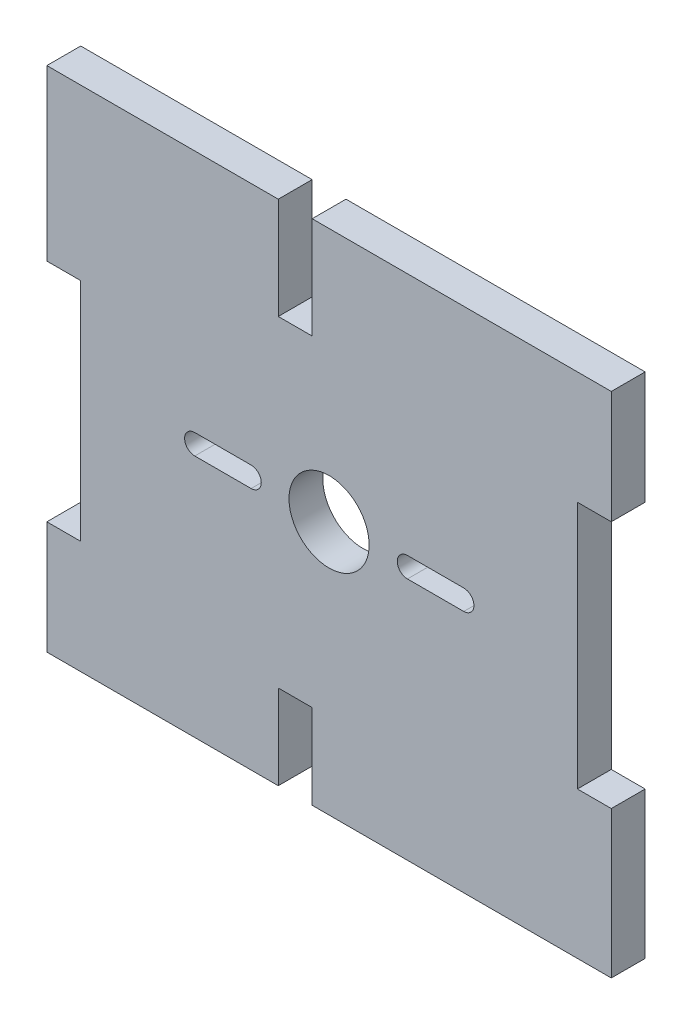
from build123d import *

# Parameters (mm, degrees)
SKETCH_1_R      = 3.55
EXTRUDE_1_DEPTH = 3


with BuildPart() as part:
    # 草图1 → 凸台-拉伸1 (new body)
    with BuildSketch(Plane.XY.offset(3)):
        Polygon((46.131858504, 44.9999), (19.632388504, 44.9999), (19.632388504, 35.9998), (16.632358504, 35.9998), (16.632358504, 44.9999), (-3.867371496, 44.9999), (-3.867371496, 29.9998), (-0.867341496, 29.9998), (-0.867341496, 9.9991), (-3.867371496, 9.9991), (-3.867371496, 0), (16.632358504, 0), (16.632358504, 7.4993), (19.632388504, 7.4993), (19.632388504, 0), (46.131858504, 0), (46.131858504, 13.0005), (43.131858504, 13.0005), (43.131858504, 34.9994), (46.131858504, 34.9994), align=None)
        with Locations(Location((21.131658504, 22.4992, 0), (0, 0, 180))):
            Circle(SKETCH_1_R, mode=Mode.SUBTRACT)
        with BuildLine():
            Line((9.236684618, 23.399), (14.226589495, 23.399))
            ThreePointArc((14.226589495, 23.399), (15.126339495, 22.49925), (14.226589495, 21.5995))
            Line((14.226589495, 21.5995), (9.236684618, 21.5995))
            ThreePointArc((9.236684618, 21.5995), (8.336934618, 22.49925), (9.236684618, 23.399))
        make_face(mode=Mode.SUBTRACT)
        with BuildLine():
            Line((33.064389495, 21.5871), (28.074484618, 21.5871))
            ThreePointArc((28.074484618, 21.5871), (27.174734618, 22.48685), (28.074484618, 23.3866))
            Line((28.074484618, 23.3866), (33.064389495, 23.3866))
            ThreePointArc((33.064389495, 23.3866), (33.964139495, 22.48685), (33.064389495, 21.5871))
        make_face(mode=Mode.SUBTRACT)
    extrude(amount=-EXTRUDE_1_DEPTH)


solid = part.part
